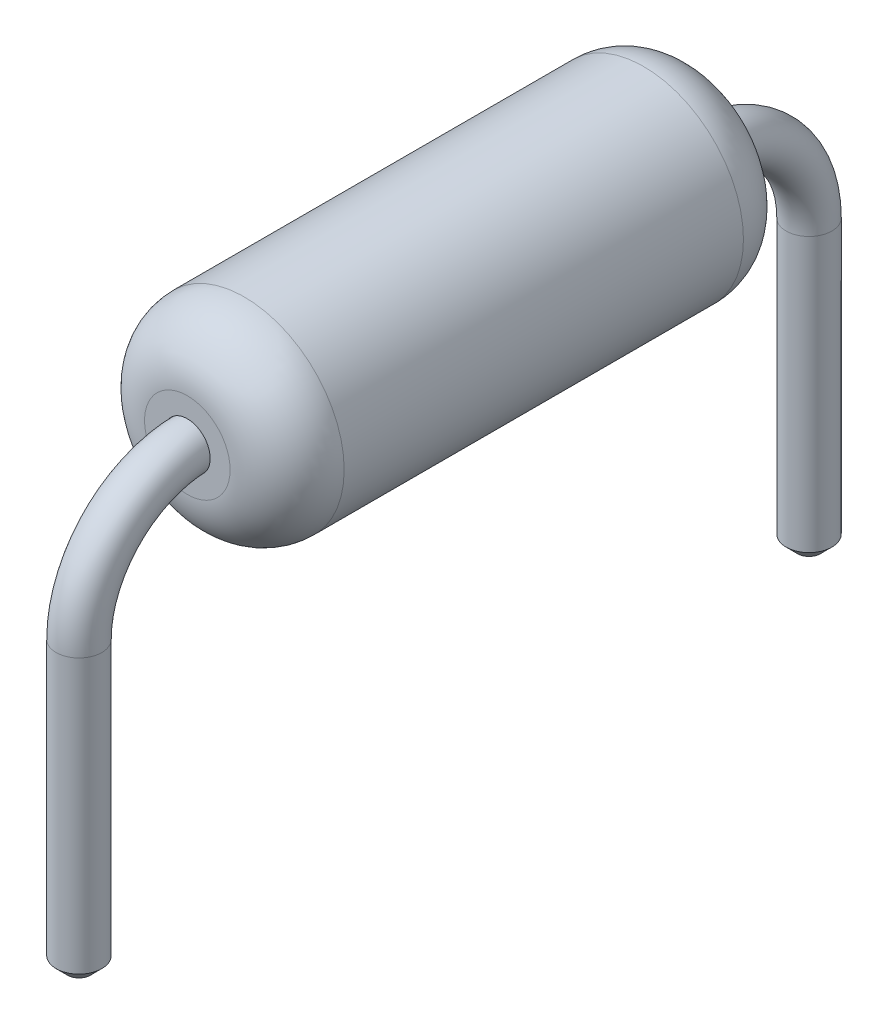
from build123d import *

# Parameters (mm, degrees)
SKETCH6_R           = 0.4
SKETCH7_R           = 1.75
SKETCH7_R_2         = 0.4
BOSS_EXTRUDE1_DEPTH = 4.5
FILLET1_R           = 1
CHAMFER1_SIZE       = 0.2


with BuildPart() as part:
    # Sweep1: sweep along a path in Sketch1
    with BuildLine(Plane(origin=(0, 0, 0), x_dir=(0, 0, -1), z_dir=(1, 0, 0))) as sweep1_path:
        Line((-6.4, -3), (-6.4, 2))
        ThreePointArc((-6.4, 2), (-5.814213562, 3.414213562), (-4.4, 4))
        Line((-4.4, 4), (4.4, 4))
        ThreePointArc((4.4, 4), (5.814213562, 3.414213562), (6.4, 2))
        Line((6.4, 2), (6.4, -3))
    # Sketch6 → Sweep1 (sweep)
    with BuildSketch(Plane(origin=(0, -3, 6.4), x_dir=(1, 0, 0), z_dir=(0, 1, 0))):
        Circle(SKETCH6_R)
    sweep(path=sweep1_path.line)

    # Chamfer1
    chamfer1_edges = [part.edges().sort_by_distance(p)[0] for p in [
        (-0.4, -3, -6.4),
        (-0.4, -3, 6.4),
    ]]
    chamfer(chamfer1_edges, length=CHAMFER1_SIZE)


with BuildPart() as body_2:
    # Sketch7 → Boss-Extrude1 (new, symmetric)
    with BuildSketch(Plane.XY):
        with Locations((0, 4)):
            Circle(SKETCH7_R)
        with Locations((0, 4)):
            Circle(SKETCH7_R_2, mode=Mode.SUBTRACT)
    extrude(amount=BOSS_EXTRUDE1_DEPTH, both=True)

    # Fillet1
    fillet1_edges = [body_2.edges().sort_by_distance(p)[0] for p in [
        (-1.75, 4, -4.5),
        (-1.75, 4, 4.5),
    ]]
    fillet(fillet1_edges, radius=FILLET1_R)


solid = Compound([part.part, body_2.part])
